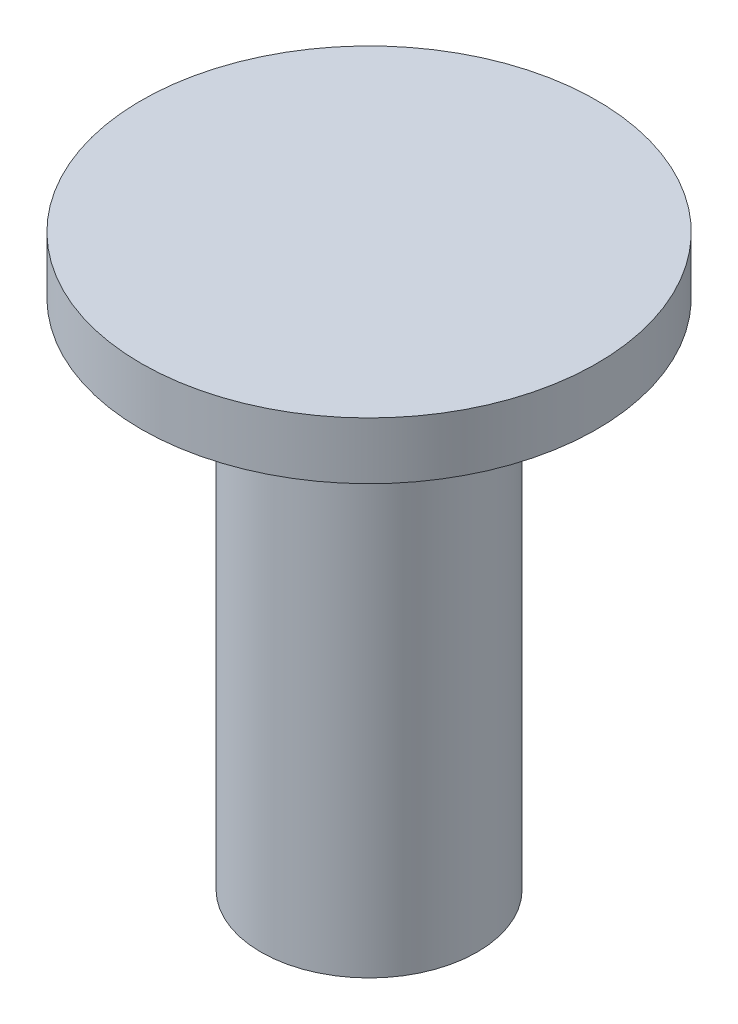
from build123d import *

# Parameters (mm, degrees)
SKETCH_1_R      = 0.95
EXTRUDE_1_DEPTH = 5
SKETCH_3_R      = 2
EXTRUDE_2_DEPTH = 0.5


with BuildPart() as part:
    # Эскиз1 → Бобышка-Вытянуть1 (new body)
    with BuildSketch(Plane(origin=(0, 0, 0), x_dir=(1, 0, 0), z_dir=(0, 1, 0))):
        with Locations(Location((0, 0, 0), (0, 0, 270))):
            Circle(SKETCH_1_R)
    extrude(amount=EXTRUDE_1_DEPTH)

    # Эскиз3 → Бобышка-Вытянуть2 (add)
    with BuildSketch(Plane(origin=(0, 5, 0), x_dir=(1, 0, 0), z_dir=(0, 1, 0))):
        with Locations(Location((0, 0, 0), (0, 0, 270))):
            Circle(SKETCH_3_R)
    extrude(amount=-EXTRUDE_2_DEPTH)


solid = part.part
